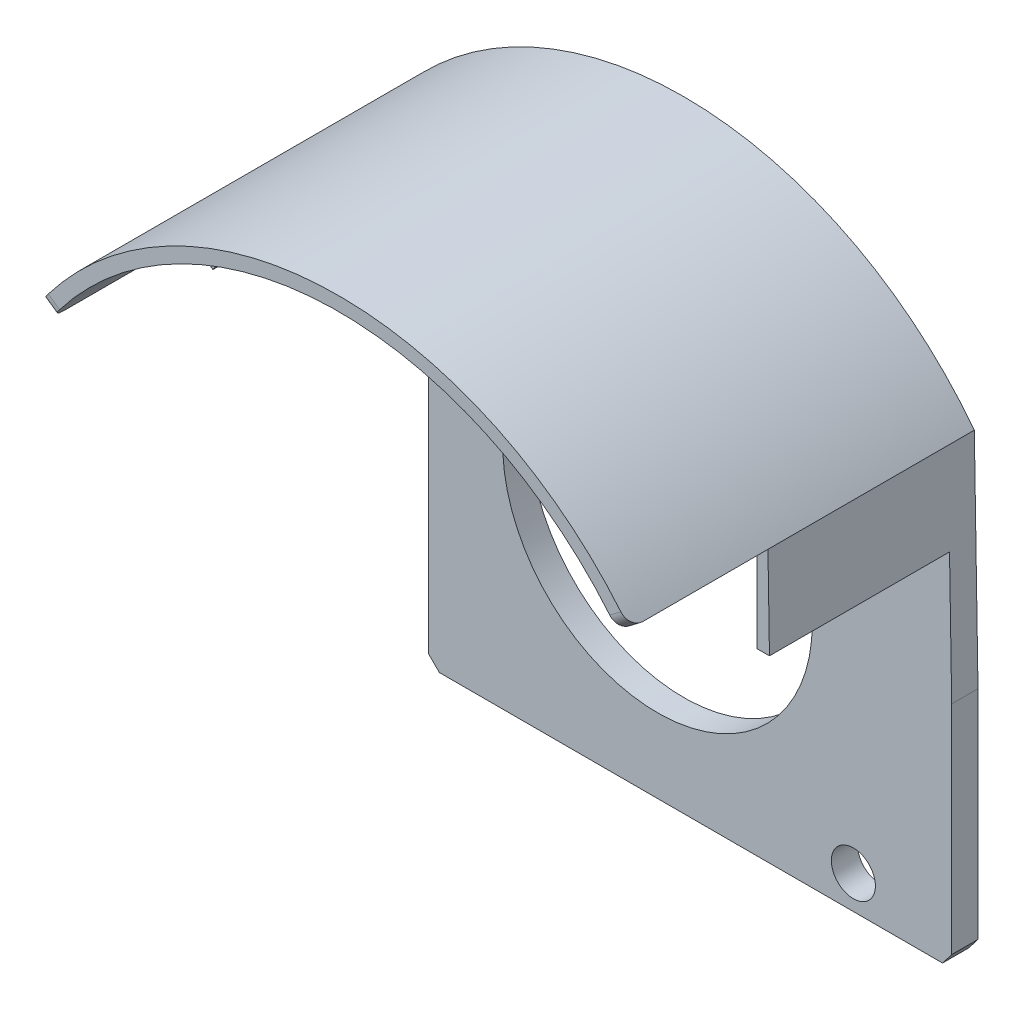
from build123d import *

# Parameters (mm, degrees)
SKETCH1_R           = 2.0193
SKETCH1_R_2         = 14.195
BOSS_EXTRUDE1_DEPTH = 2.413
BOSS_EXTRUDE2_DEPTH = 29.21
BOSS_EXTRUDE9_DEPTH = 16.51
FILLET1_R           = 1.27


with BuildPart() as part:
    # Sketch1 → Boss-Extrude1 (new body)
    with BuildSketch(Plane.XY):
        with BuildLine():
            Line((-21, 14.827700733), (-21, -20))
            Line((-21, -20), (-20, -21))
            Line((-20, -21), (26.136694206, -21))
            Line((26.136694206, -21), (26.9748, -19.911980036))
            Line((26.9748, -19.911980036), (26.9748, 0))
            Line((26.9748, 0), (26.637921908, 20.360449416))
            ThreePointArc((26.637921908, 20.360449416), (-0.633988092, 33.522005356), (-27.388735161, 19.338665163))
            Line((-27.388735161, 19.338665163), (-21, 14.827700733))
        make_face()
        with Locations((-17.960512242, 17.960512242)):
            Circle(SKETCH1_R, mode=Mode.SUBTRACT)
        with Locations((17.960512242, -17.960512242)):
            Circle(SKETCH1_R, mode=Mode.SUBTRACT)
        Circle(SKETCH1_R_2, mode=Mode.SUBTRACT)
    extrude(amount=BOSS_EXTRUDE1_DEPTH)

    # Sketch2 → Boss-Extrude2 (add)
    with BuildSketch(Plane.XY.offset(2.413)):
        with BuildLine():
            Line((-26.362552713, 18.590168866), (-27.400448489, 19.322065278))
            ThreePointArc((-27.400448489, 19.322065278), (-0.644144472, 33.521811734), (26.637921908, 20.360449416))
            Line((26.637921908, 20.360449416), (25.628909714, 19.589220272))
            ThreePointArc((25.628909714, 19.589220272), (-0.619745061, 32.252046138), (-26.362552713, 18.590168866))
        make_face()
    extrude(amount=BOSS_EXTRUDE2_DEPTH)

    # Sketch3 → Boss-Extrude9 (add)
    with BuildSketch(Plane.XY.offset(2.413)):
        with BuildLine():
            Line((-23.55281498, 18.123360163), (-25.598477532, 19.628971243))
            ThreePointArc((-25.598477532, 19.628971243), (-25.979914408, 19.121260716), (-26.351283072, 18.606139967))
            Line((-26.351283072, 18.606139967), (-24.25635866, 17.12695367))
            Line((-24.25635866, 17.12695367), (-23.55281498, 18.123360163))
        make_face()
        with BuildLine():
            Line((-1.244999497, 25.907990312), (-1.244999497, 32.23396563))
            ThreePointArc((-1.244999497, 32.23396563), (-0.610117761, 32.252229695), (0.025000503, 32.257990312))
            Line((0.025000503, 32.257990312), (0.025000503, 25.907990312))
            Line((0.025000503, 25.907990312), (-1.244999497, 25.907990312))
        make_face()
        Polygon((25.628909714, 19.589220272), (25.628909714, 11.969220272), (26.776760752, 11.969220272), (26.637921908, 20.360449416), align=None)
    extrude(amount=BOSS_EXTRUDE9_DEPTH)

    # Fillet1
    fillet1_edges = [part.edges().sort_by_distance(p)[0] for p in [
        (-24.194367581, 17.083182948, 0),
        (-26.881500601, 18.956117072, 31.623),
        (26.133415811, 19.974834844, 31.623),
    ]]
    fillet(fillet1_edges, radius=FILLET1_R)


solid = part.part
